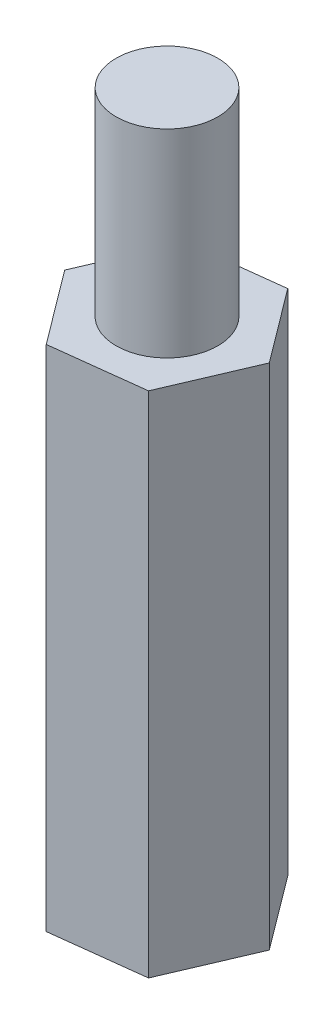
from build123d import *

# Parameters (mm, degrees)
SKETCH1_R           = 1.5
BOSS_EXTRUDE1_DEPTH = 15
SKETCH2_R           = 1.5
BOSS_EXTRUDE2_DEPTH = 5.85


with BuildPart() as part:
    # Sketch1 → Boss-Extrude1 (new body)
    with BuildSketch(Plane(origin=(0, 0, 0), x_dir=(1, 0, 0), z_dir=(0, 1, 0))):
        Polygon((-2.694283581, -0.322752721), (-1.067629735, -2.494694386), (1.626653846, -2.171941666), (2.694283581, 0.322752721), (1.067629735, 2.494694386), (-1.626653846, 2.171941666), align=None)
        with Locations(Location((0, 0, 0), (0, 0, 270))):
            Circle(SKETCH1_R, mode=Mode.SUBTRACT)
    extrude(amount=BOSS_EXTRUDE1_DEPTH)


with BuildPart() as body_2:
    # Sketch2 → Boss-Extrude2 (new body)
    with BuildSketch(Plane(origin=(0, 15, 0), x_dir=(1, 0, 0), z_dir=(0, 1, 0))):
        with Locations(Location((0, 0, 0), (0, 0, 270))):
            Circle(SKETCH2_R)
    extrude(amount=BOSS_EXTRUDE2_DEPTH)


solid = Compound([part.part, body_2.part])
